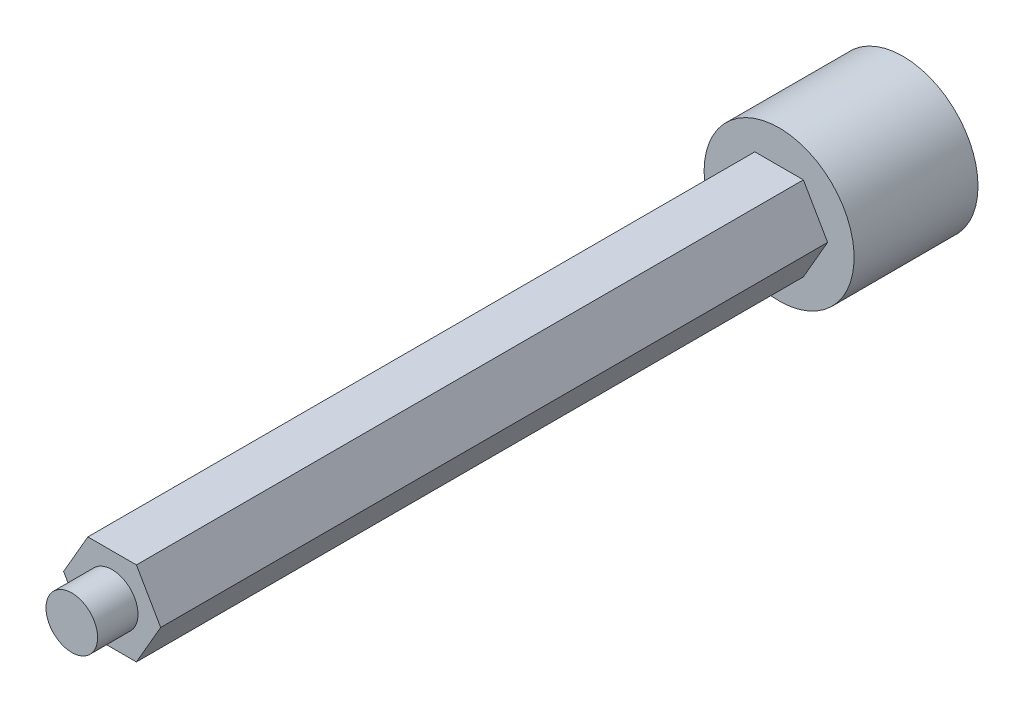
from build123d import *

# Parameters (mm, degrees)
HEX_EXTRUDE_DEPTH      = 58.145
MOTOR_SHAFT_DEPTH      = 9
SKETCH15_R             = 5.666174209
SKETCH15_R_2           = 2.2
MOTOR_SPACER_DEPTH     = 1.6
SKETCH16_R             = 5.666174209
HUB_INNER_SPACER_DEPTH = 7.76
SKETCH14_R             = 1.95
BEARING_DEPTH          = 3.048


with BuildPart() as part:
    # Standoff → Hex extrude (new body)
    with BuildSketch(Plane.XY.offset(1.6)):
        Polygon((3.666174209, 0), (1.833087105, 3.175), (-1.833087105, 3.175), (-3.666174209, 0), (-1.833087105, -3.175), (1.833087105, -3.175), align=None)
    extrude(amount=HEX_EXTRUDE_DEPTH)

    # Sketch12 → Motor shaft (cut)
    with BuildSketch(Plane.XY.offset(1.6)):
        with BuildLine():
            Line((1.394668419, 1.57), (-1.394668419, 1.57))
            ThreePointArc((-1.394668419, 1.57), (0, -2.1), (1.394668419, 1.57))
        make_face()
    extrude(amount=MOTOR_SHAFT_DEPTH, mode=Mode.SUBTRACT)

    # Sketch15 → Motor spacer (add)
    with BuildSketch(Plane.XY):
        Circle(SKETCH15_R)
        Circle(SKETCH15_R_2, mode=Mode.SUBTRACT)
    extrude(amount=MOTOR_SPACER_DEPTH)

    # Sketch16 → Hub inner spacer (add)
    with BuildSketch(Plane.XY.offset(1.6)):
        with Locations(Location((0, 0, 0), (0, 0, 180))):
            Circle(SKETCH16_R)
        Polygon((3.666174209, 0), (1.833087105, 3.175), (-1.833087105, 3.175), (-3.666174209, 0), (-1.833087105, -3.175), (1.833087105, -3.175), align=None, mode=Mode.SUBTRACT)
    extrude(amount=HUB_INNER_SPACER_DEPTH)

    # Sketch14 → Bearing (add)
    with BuildSketch(Plane.XY.offset(59.745)):
        with Locations(Location((0, 0, 0), (0, 0, 270))):
            Circle(SKETCH14_R)
    extrude(amount=BEARING_DEPTH)


solid = part.part
